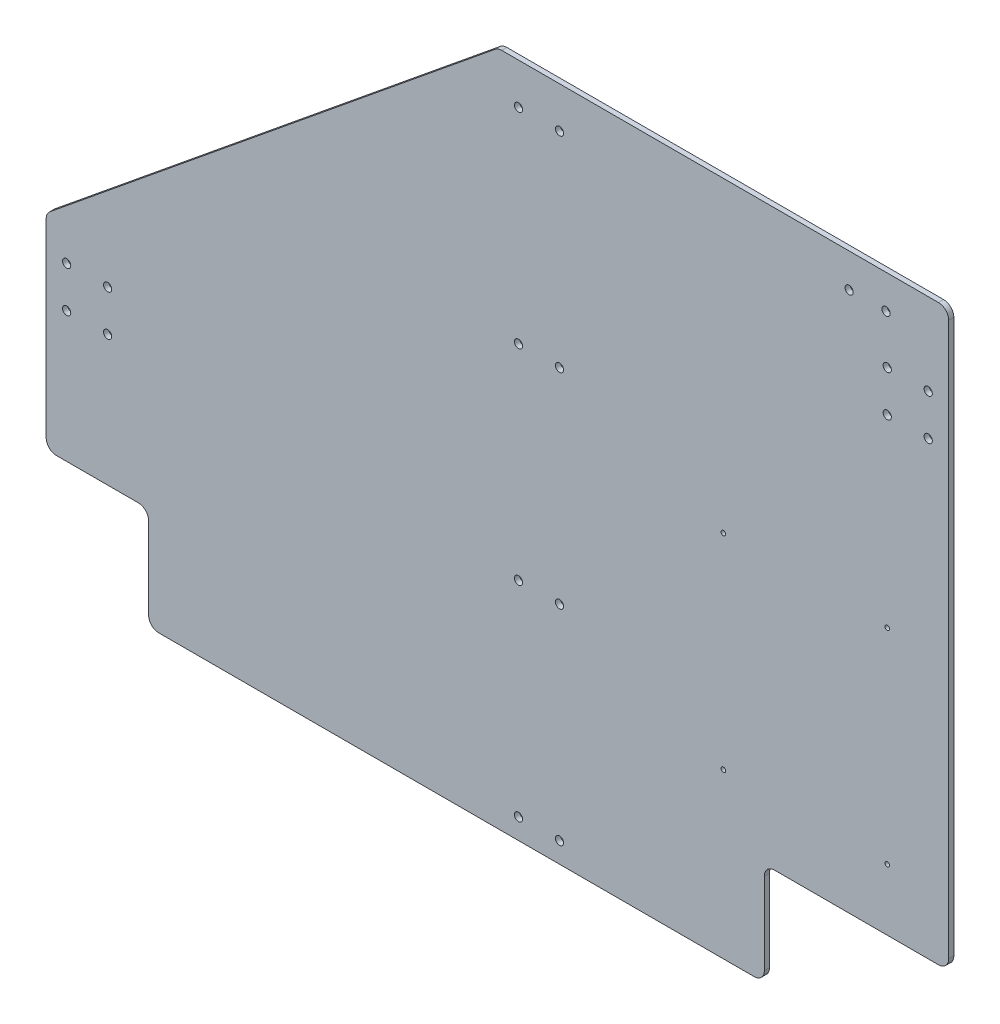
from build123d import *

# Parameters (mm, degrees)
SKETCH1_R           = 2.54
SKETCH1_W           = 50.8
SKETCH1_H           = 355.6
BOSS_EXTRUDE1_DEPTH = 3.175
FILLET1_R           = 6.35
SKETCH3_R           = 1.4224
CUT_EXTRUDE3_DEPTH  = 700.116959077
SKETCH5_R           = 2.54
CUT_EXTRUDE5_DEPTH  = 700.116959077


with BuildPart() as part:
    # Sketch1 → Boss-Extrude1 (new body)
    # profile 1 of 2: a face of its own
    with BuildSketch(Plane.XY):
        Polygon((0, 190.5), (0, 63.5), (63.5, 63.5), (63.5, 0), (445.262, 0), (445.262, 63.5), (508.762, 63.5), (508.762, 419.1), (280.162, 419.1), align=None)
        with Locations((12.7, 144.4625)):
            Circle(SKETCH1_R, mode=Mode.SUBTRACT)
        with Locations((38.1, 144.4625)):
            Circle(SKETCH1_R, mode=Mode.SUBTRACT)
        with Locations((12.7, 169.8625)):
            Circle(SKETCH1_R, mode=Mode.SUBTRACT)
        with Locations((38.1, 169.8625)):
            Circle(SKETCH1_R, mode=Mode.SUBTRACT)
        with Locations((292.862, 12.7)):
            Circle(SKETCH1_R, mode=Mode.SUBTRACT)
        with Locations((318.262, 12.7)):
            Circle(SKETCH1_R, mode=Mode.SUBTRACT)
        with Locations((292.862, 139.7)):
            Circle(SKETCH1_R, mode=Mode.SUBTRACT)
        with Locations((318.262, 139.7)):
            Circle(SKETCH1_R, mode=Mode.SUBTRACT)
        with Locations((292.862, 266.7)):
            Circle(SKETCH1_R, mode=Mode.SUBTRACT)
        with Locations((318.262, 266.7)):
            Circle(SKETCH1_R, mode=Mode.SUBTRACT)
        with Locations((292.862, 393.7)):
            Circle(SKETCH1_R, mode=Mode.SUBTRACT)
        with Locations((318.262, 393.7)):
            Circle(SKETCH1_R, mode=Mode.SUBTRACT)
    # profile 2 of 2: a face of its own
    with BuildSketch(Plane.XY):
        with Locations((534.162, 241.3)):
            Rectangle(SKETCH1_W, SKETCH1_H)
        with Locations((521.462, 342.9)):
            Circle(SKETCH1_R, mode=Mode.SUBTRACT)
        with Locations((546.862, 342.9)):
            Circle(SKETCH1_R, mode=Mode.SUBTRACT)
        with Locations((521.462, 368.3)):
            Circle(SKETCH1_R, mode=Mode.SUBTRACT)
        with Locations((546.862, 368.3)):
            Circle(SKETCH1_R, mode=Mode.SUBTRACT)
    extrude(amount=BOSS_EXTRUDE1_DEPTH)

    # Fillet1
    fillet1_edges = [part.edges().sort_by_distance(p)[0] for p in [
        (280.162, 419.1, 1.5875),
        (559.562, 419.1, 1.5875),
        (559.562, 63.5, 1.5875),
        (445.262, 63.5, 1.5875),
        (445.262, 0, 1.5875),
        (63.5, 0, 1.5875),
        (63.5, 63.5, 1.5875),
        (0, 63.5, 1.5875),
        (0, 190.5, 1.5875),
    ]]
    fillet(fillet1_edges, radius=FILLET1_R)

    # Sketch3 → Cut-Extrude3 (cut, through all)
    with BuildSketch(Plane.XY.offset(3.175)):
        with Locations((521.462, 228.6)):
            Circle(SKETCH3_R)
        with Locations((419.862, 228.6)):
            Circle(SKETCH3_R)
        with Locations((419.862, 101.6)):
            Circle(SKETCH3_R)
        with Locations((521.462, 101.6)):
            Circle(SKETCH3_R)
    extrude(amount=-CUT_EXTRUDE3_DEPTH, mode=Mode.SUBTRACT)

    # Sketch5 → Cut-Extrude5 (cut, through all)
    with BuildSketch(Plane.XY.offset(3.175)):
        with Locations((520.7, 398.145)):
            Circle(SKETCH5_R)
        with Locations((497.84, 398.145)):
            Circle(SKETCH5_R)
    extrude(amount=-CUT_EXTRUDE5_DEPTH, mode=Mode.SUBTRACT)


solid = part.part
